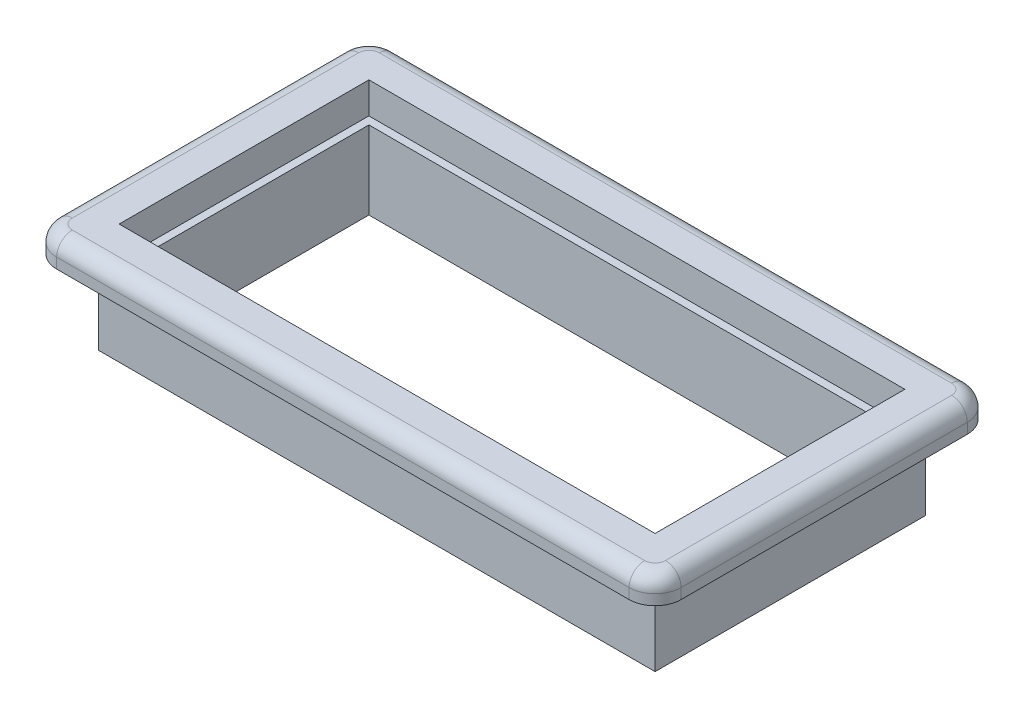
from build123d import *

# Parameters (mm, degrees)
SKETCH1_W           = 100
SKETCH1_H           = 45
BOSS_EXTRUDE1_DEPTH = 5
SKETCH2_W           = 107
SKETCH2_H           = 52
SKETCH2_W_2         = 100
SKETCH2_H_2         = 45
BOSS_EXTRUDE2_DEPTH = 16
FILLET1_R           = 3
SKETCH3_W           = 103
SKETCH3_H           = 48
SKETCH3_W_2         = 100
SKETCH3_H_2         = 45
CUT_EXTRUDE1_DEPTH  = 6


with BuildPart() as part:
    # Sketch1 → Boss-Extrude1 (new body)
    with BuildSketch(Plane(origin=(0, 0, 0), x_dir=(1, 0, 0), z_dir=(0, 1, 0))):
        with BuildLine():
            Line((-55, -32.5), (55, -32.5))
            ThreePointArc((55, -32.5), (58.535533906, -31.035533906), (60, -27.5))
            Line((60, -27.5), (60, 27.5))
            ThreePointArc((60, 27.5), (58.535533906, 31.035533906), (55, 32.5))
            Line((55, 32.5), (-55, 32.5))
            ThreePointArc((-55, 32.5), (-58.535533906, 31.035533906), (-60, 27.5))
            Line((-60, 27.5), (-60, -27.5))
            ThreePointArc((-60, -27.5), (-58.535533906, -31.035533906), (-55, -32.5))
        make_face()
        Rectangle(SKETCH1_W, SKETCH1_H, mode=Mode.SUBTRACT)
    extrude(amount=BOSS_EXTRUDE1_DEPTH)

    # Sketch2 → Boss-Extrude2 (add)
    with BuildSketch(Plane.XZ):
        Rectangle(SKETCH2_W, SKETCH2_H)
        Rectangle(SKETCH2_W_2, SKETCH2_H_2, mode=Mode.SUBTRACT)
    extrude(amount=BOSS_EXTRUDE2_DEPTH)

    # Fillet1
    fillet1_edges = [part.edges().sort_by_distance(p)[0] for p in [
        (58.535533906, 5, 31.035533906),
        (60, 5, 0),
        (58.535533906, 5, -31.035533906),
        (0, 5, -32.5),
        (-58.535533906, 5, -31.035533906),
        (-60, 5, 0),
        (-58.535533906, 5, 31.035533906),
        (0, 5, 32.5),
    ]]
    fillet(fillet1_edges, radius=FILLET1_R)

    # Sketch3 → Cut-Extrude1 (cut)
    with BuildSketch(Plane(origin=(0, 5, 0), x_dir=(1, 0, 0), z_dir=(0, 1, 0))):
        Rectangle(SKETCH3_W, SKETCH3_H)
        Rectangle(SKETCH3_W_2, SKETCH3_H_2, mode=Mode.SUBTRACT)
    extrude(amount=-CUT_EXTRUDE1_DEPTH, mode=Mode.SUBTRACT)


solid = part.part
